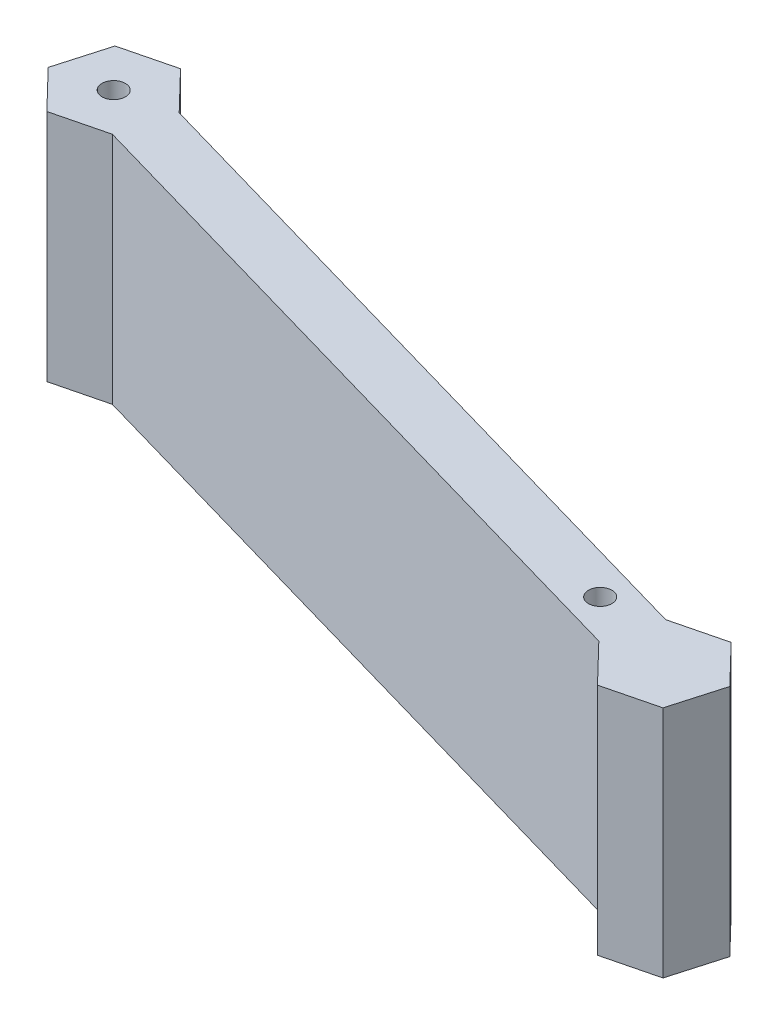
from build123d import *

# Parameters (mm, degrees)
RESSALTO_EXTRUS_O1_DEPTH = 30
ESBO_O2_R                = 1.5
CORTE_EXTRUS_O1_DEPTH    = 30
ESBO_O4_W                = 6.92820323
ESBO_O4_H                = 30
RESSALTO_EXTRUS_O2_DEPTH = 91
RESSALTO_EXTRUS_O3_DEPTH = 30


with BuildPart() as part:
    # Esboço1 → Ressalto-extrusão1 (new body)
    with BuildSketch(Plane(origin=(0, 0, 0), x_dir=(1, 0, 0), z_dir=(0, 1, 0))):
        Polygon((4.812291954, -4.984159523), (6.72255474, 1.675487321), (1.910262787, 6.659646844), (-4.812291954, 4.984159523), (-6.72255474, -1.675487321), (-1.910262787, -6.659646844), align=None)
    extrude(amount=RESSALTO_EXTRUS_O1_DEPTH)

    # Esboço2 → Corte-extrusão1 (cut)
    with BuildSketch(Plane.XZ):
        with Locations(Location((0, 0, 0), (0, 0, 270))):
            Circle(ESBO_O2_R)
    corte_extrus_o1 = extrude(amount=-CORTE_EXTRUS_O1_DEPTH, mode=Mode.SUBTRACT)

    # Esboço4 → Ressalto-extrusão2 (add)
    with BuildSketch(Plane(origin=(5.767423347, 0, 1.654336101), x_dir=(0.27572268356451307, 0, -0.961237224501831), z_dir=(0.961237224501831, 0, 0.27572268356451307))):
        with Locations((0, 15)):
            Rectangle(ESBO_O4_W, ESBO_O4_H)
    extrude(amount=RESSALTO_EXTRUS_O2_DEPTH)

    # Esboço5 → Ressalto-extrusão3 (add, through all)
    with BuildSketch(Plane(origin=(0, 0, 0), x_dir=(1, 0, 0), z_dir=(0, 1, 0))):
        Polygon((105.729988864, -26.723949087), (100.917696911, -21.739789563), (94.19514217, -23.415276884), (92.284879383, -30.074923728), (97.097171337, -35.059083251), (103.819726077, -33.38359593), align=None)
    extrude(amount=RESSALTO_EXTRUS_O3_DEPTH)

    # Espelhar1: Corte-extrusão1 across plane
    add(corte_extrus_o1.mirror(Plane(origin=(43.736293715, 0, 12.545382102), x_dir=(-0.2757226835645132, 0, 0.9612372245018309), z_dir=(-0.961237224501831, 0, -0.2757226835645132))), mode=Mode.SUBTRACT)


solid = part.part
